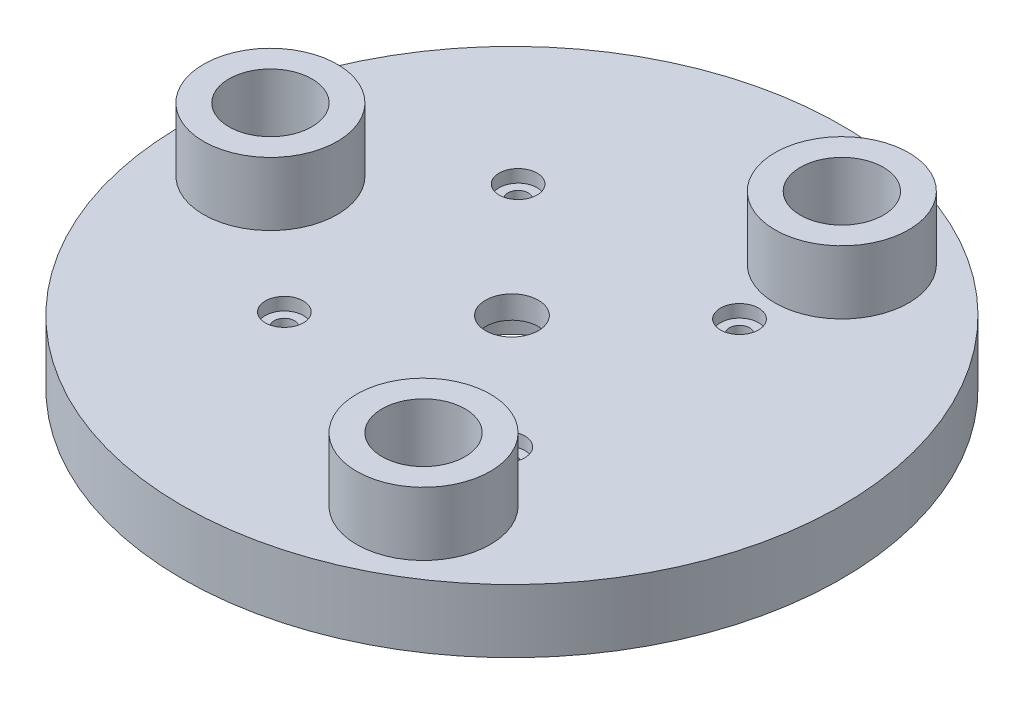
from build123d import *

# Parameters (mm, degrees)
SKETCH2_R               = 26
SKETCH2_R_2             = 2.085648148
BOSS_EXTRUDE2_DEPTH     = 10
SKETCH3_R               = 3.275
CUT_EXTRUDE1_DEPTH      = 7.5
CUT_EXTRUDE2_START      = -5
SKETCH4_R               = 26
SKETCH4_R_2             = 5.275
CUT_EXTRUDE2_DEPTH      = 5
SKETCH5_R               = 5.25
CUT_EXTRUDE3_DEPTH      = 3.2
CUT_EXTRUDE4_DEPTH      = 38.107950631
CUT_EXTRUDE4_DEPTH_BACK = 38.107950631
SKETCH6_R               = 0.8
SKETCH7_R               = 1.500000048
CUT_EXTRUDE5_DEPTH      = 1


with BuildPart() as part:
    # Sketch2 → Boss-Extrude2 (new body)
    with BuildSketch(Plane(origin=(0, 0, 0), x_dir=(1, 0, 0), z_dir=(0, 1, 0))):
        with Locations(Location((0, 0, 0), (0, 0, 270))):
            Circle(SKETCH2_R)
        with Locations(Location((0, 0, 0), (0, 0, 270))):
            Circle(SKETCH2_R_2, mode=Mode.SUBTRACT)
    extrude(amount=BOSS_EXTRUDE2_DEPTH)

    # Sketch3 → Cut-Extrude1 (cut)
    with BuildSketch(Plane.XZ.offset(-10)):
        with Locations(Location((9.52625, -16.499949006, 0), (0, 0, 270))):
            Circle(SKETCH3_R)
        with Locations(Location((9.52625, 16.499949006, 0), (0, 0, 270))):
            Circle(SKETCH3_R)
        with Locations(Location((-19.0525, 0, 0), (0, 0, 270))):
            Circle(SKETCH3_R)
    extrude(amount=CUT_EXTRUDE1_DEPTH, mode=Mode.SUBTRACT)

    # Sketch4 → Cut-Extrude2 (cut)
    with BuildSketch(Plane(origin=(0, 10, 0), x_dir=(1, 0, 0), z_dir=(0, 1, 0)).offset(CUT_EXTRUDE2_START)):
        with Locations(Location((0, 0, 0), (0, 0, 270))):
            Circle(SKETCH4_R)
        with Locations(Location((-19.0525, 0, 0), (0, 0, 270))):
            Circle(SKETCH4_R_2, mode=Mode.SUBTRACT)
        with Locations(Location((9.52625, -16.499949006, 0), (0, 0, 270))):
            Circle(SKETCH4_R_2, mode=Mode.SUBTRACT)
        with Locations(Location((9.52625, 16.499949006, 0), (0, 0, 270))):
            Circle(SKETCH4_R_2, mode=Mode.SUBTRACT)
    extrude(amount=CUT_EXTRUDE2_DEPTH, mode=Mode.SUBTRACT)

    # Sketch5 → Cut-Extrude3 (cut)
    with BuildSketch(Plane.XZ):
        with Locations(Location((0, 0, 0), (0, 0, 270))):
            Circle(SKETCH5_R)
    extrude(amount=-CUT_EXTRUDE3_DEPTH, mode=Mode.SUBTRACT)

    # Sketch6 → Cut-Extrude4 (cut, two sides: drawn at the far end of the back side and taken through both)
    with BuildSketch(Plane(origin=(0, 5, 0), x_dir=(1, 0, 0), z_dir=(0, 1, 0)).offset(-CUT_EXTRUDE4_DEPTH_BACK)):
        with Locations(Location((-8.733127343, 9.220763895, 0), (0, 0, 270))):
            Circle(SKETCH6_R)
        with Locations(Location((9.220763895, 8.733127343, 0), (0, 0, 270))):
            Circle(SKETCH6_R)
        with Locations(Location((8.733127343, -9.220763895, 0), (0, 0, 270))):
            Circle(SKETCH6_R)
        with Locations(Location((-9.220763895, -8.733127343, 0), (0, 0, 270))):
            Circle(SKETCH6_R)
    extrude(amount=CUT_EXTRUDE4_DEPTH + CUT_EXTRUDE4_DEPTH_BACK, mode=Mode.SUBTRACT)

    # Sketch7 → Cut-Extrude5 (cut)
    with BuildSketch(Plane(origin=(0, 5, 0), x_dir=(1, 0, 0), z_dir=(0, 1, 0))):
        with Locations(Location((-8.733127343, 9.220763895, 0), (0, 0, 270))):
            Circle(SKETCH7_R)
        with Locations(Location((9.220763895, 8.733127343, 0), (0, 0, 270))):
            Circle(SKETCH7_R)
        with Locations(Location((8.733127343, -9.220763895, 0), (0, 0, 270))):
            Circle(SKETCH7_R)
        with Locations(Location((-9.220763895, -8.733127343, 0), (0, 0, 270))):
            Circle(SKETCH7_R)
    extrude(amount=-CUT_EXTRUDE5_DEPTH, mode=Mode.SUBTRACT)


solid = part.part
